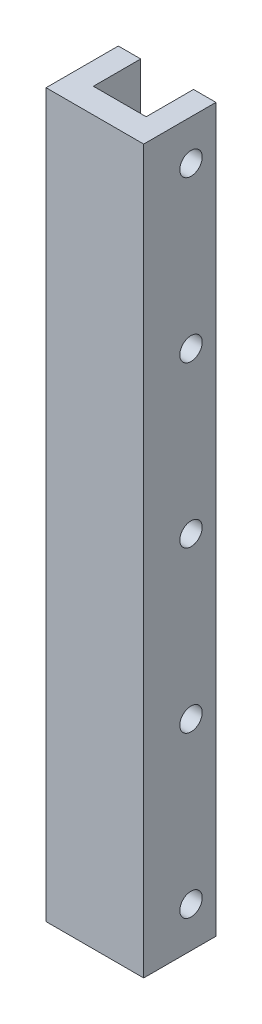
from build123d import *

# Parameters (mm, degrees)
EXTRUDE_1_DEPTH     = 145
SKETCH_2_R          = 2.25
CUT_EXTRUDE_1_DEPTH = 147.626771089


with BuildPart() as part:
    # Эскиз1 → Бобышка-Вытянуть1 (new body)
    with BuildSketch(Plane(origin=(0, 0, 0), x_dir=(1, 0, 0), z_dir=(0, 1, 0))):
        Polygon((0, 0), (10.6, 0), (10.6, 9.5), (15.1, 9.5), (15.1, -5), (-4.5, -5), (-4.5, 9.5), (0, 9.5), align=None)
    extrude(amount=EXTRUDE_1_DEPTH)

    # Эскиз2 → Вырез-Вытянуть1 (cut, through all)
    with BuildSketch(Plane(origin=(15.1, 0, 0), x_dir=(0, 0, -1), z_dir=(1, 0, 0))):
        with Locations((4.5, 40.3)):
            Circle(SKETCH_2_R)
        with Locations((4.5, 8.1)):
            Circle(SKETCH_2_R)
        with Locations((4.5, 72.5)):
            Circle(SKETCH_2_R)
        with Locations((4.5, 104.7)):
            Circle(SKETCH_2_R)
        with Locations((4.5, 136.9)):
            Circle(SKETCH_2_R)
    extrude(amount=-CUT_EXTRUDE_1_DEPTH, mode=Mode.SUBTRACT)


solid = part.part
